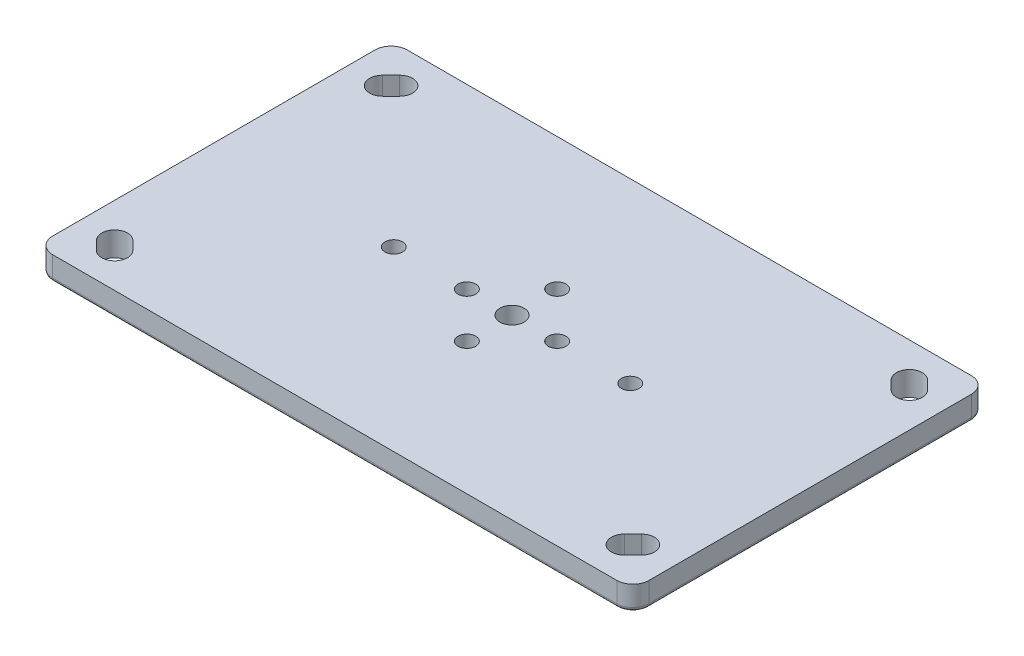
from build123d import *

# Parameters (mm, degrees)
SKETCH1_W                       = 93.98
SKETCH1_H                       = 55.88
SKETCH1_R                       = 1.905
BOSS_EXTRUDE1_DEPTH             = 3.81
F_7_64_0_10938_DIAMETER_HOLE1_D = 2.778252
FILLET1_R                       = 2.54
EXTRUDE_THIN1_DEPTH             = 3.81
FILLET2_R                       = 1.27
FILLET3_R                       = 0.635


with BuildPart() as part:
    # Sketch1 → Boss-Extrude1 (new body)
    with BuildSketch(Plane(origin=(0, 0, 0), x_dir=(1, 0, 0), z_dir=(0, 1, 0))):
        Rectangle(SKETCH1_W, SKETCH1_H)
        with Locations(Location((0, 0, 0), (0, 0, 90))):
            Circle(SKETCH1_R, mode=Mode.SUBTRACT)
        with BuildLine():
            Line((40.073298182, 19.676259764), (38.726259764, 21.023298182))
            ThreePointArc((38.726259764, 21.023298182), (38.726259764, 23.896980141), (41.599941723, 23.896980141))
            Line((41.599941723, 23.896980141), (42.946980141, 22.549941723))
            ThreePointArc((42.946980141, 22.549941723), (42.946980141, 19.676259764), (40.073298182, 19.676259764))
        make_face(mode=Mode.SUBTRACT)
        with BuildLine():
            Line((-40.073298182, 19.676259764), (-38.726259764, 21.023298182))
            ThreePointArc((-38.726259764, 21.023298182), (-38.726259764, 23.896980141), (-41.599941723, 23.896980141))
            Line((-41.599941723, 23.896980141), (-42.946980141, 22.549941723))
            ThreePointArc((-42.946980141, 22.549941723), (-42.946980141, 19.676259764), (-40.073298182, 19.676259764))
        make_face(mode=Mode.SUBTRACT)
        with BuildLine():
            Line((40.073298182, -19.676259764), (38.726259764, -21.023298182))
            ThreePointArc((38.726259764, -21.023298182), (38.726259764, -23.896980141), (41.599941723, -23.896980141))
            Line((41.599941723, -23.896980141), (42.946980141, -22.549941723))
            ThreePointArc((42.946980141, -22.549941723), (42.946980141, -19.676259764), (40.073298182, -19.676259764))
        make_face(mode=Mode.SUBTRACT)
        with BuildLine():
            Line((-40.073298182, -19.676259764), (-38.726259764, -21.023298182))
            ThreePointArc((-38.726259764, -21.023298182), (-38.726259764, -23.896980141), (-41.599941723, -23.896980141))
            Line((-41.599941723, -23.896980141), (-42.946980141, -22.549941723))
            ThreePointArc((-42.946980141, -22.549941723), (-42.946980141, -19.676259764), (-40.073298182, -19.676259764))
        make_face(mode=Mode.SUBTRACT)
    extrude(amount=BOSS_EXTRUDE1_DEPTH)

    # 7/64 (0.10938) Diameter Hole1 (through all)
    with Locations(Plane(origin=(0, 0, 0), x_dir=(-1, 0, 0), z_dir=(0, -1, 0))):
        with Locations((-18.6309, 0), (0, 7.112), (-7.112, 0), (7.112, 0), (18.6309, 0), (0, -7.112)):
            Hole(F_7_64_0_10938_DIAMETER_HOLE1_D / 2)

    # Fillet1
    fillet1_edges = [part.edges().sort_by_distance(p)[0] for p in [
        (-46.99, 1.905, 27.94),
        (46.99, 1.905, 27.94),
        (46.99, 1.905, -27.94),
        (-46.99, 1.905, -27.94),
    ]]
    fillet(fillet1_edges, radius=FILLET1_R)

    # Sketch4 → Extrude-Thin1 (add)
    with BuildSketch(Plane(origin=(0, 0, 0), x_dir=(1, 0, 0), z_dir=(0, 1, 0))):
        with BuildLine():
            Line((-40.64, 10.16), (-40.64, -10.16))
            ThreePointArc((-40.64, -10.16), (-36.920256121, -19.140256121), (-27.94, -22.86))
            Line((-27.94, -22.86), (27.94, -22.86))
            ThreePointArc((27.94, -22.86), (36.920256121, -19.140256121), (40.64, -10.16))
            Line((40.64, -10.16), (40.64, 10.16))
            ThreePointArc((40.64, 10.16), (36.920256121, 19.140256121), (27.94, 22.86))
            Line((27.94, 22.86), (-27.94, 22.86))
            ThreePointArc((-27.94, 22.86), (-36.920256121, 19.140256121), (-40.64, 10.16))
        make_face()
        with BuildLine():
            Line((-36.83, 10.16), (-36.83, -10.16))
            ThreePointArc((-36.83, -10.16), (-34.226179285, -16.446179285), (-27.94, -19.05))
            Line((-27.94, -19.05), (27.94, -19.05))
            ThreePointArc((27.94, -19.05), (34.226179285, -16.446179285), (36.83, -10.16))
            Line((36.83, -10.16), (36.83, 10.16))
            ThreePointArc((36.83, 10.16), (34.226179285, 16.446179285), (27.94, 19.05))
            Line((27.94, 19.05), (-27.94, 19.05))
            ThreePointArc((-27.94, 19.05), (-34.226179285, 16.446179285), (-36.83, 10.16))
        make_face(mode=Mode.SUBTRACT)
    extrude(amount=-EXTRUDE_THIN1_DEPTH)

    # Fillet2
    fillet2_edges = [part.edges().sort_by_distance(p)[0] for p in [
        (-36.920256121, -3.81, 19.140256121),
        (-40.64, -3.81, 0),
        (-36.920256121, -3.81, -19.140256121),
        (0, -3.81, -22.86),
        (36.920256121, -3.81, -19.140256121),
        (40.64, -3.81, 0),
        (36.920256121, -3.81, 19.140256121),
        (0, -3.81, 22.86),
        (-36.83, -3.81, 0),
        (-34.226179285, -3.81, 16.446179285),
        (0, -3.81, 19.05),
        (34.226179285, -3.81, 16.446179285),
        (36.83, -3.81, 0),
        (34.226179285, -3.81, -16.446179285),
        (0, -3.81, -19.05),
        (-34.226179285, -3.81, -16.446179285),
    ]]
    fillet(fillet2_edges, radius=FILLET2_R)

    # Fillet3
    fillet3_edges = [part.edges().sort_by_distance(p)[0] for p in [
        (-46.99, 0, 0),
        (0, 0, -27.94),
        (46.99, 0, 0),
        (0, 0, 27.94),
        (46.246051224, 0, 27.196051224),
        (46.246051224, 0, -27.196051224),
        (-46.246051224, 0, 27.196051224),
        (-46.246051224, 0, -27.196051224),
        (-36.920256121, 0, 19.140256121),
        (0, 0, 22.86),
        (36.920256121, 0, 19.140256121),
        (40.64, 0, 0),
        (36.920256121, 0, -19.140256121),
        (0, 0, -22.86),
        (-36.920256121, 0, -19.140256121),
        (-40.64, 0, 0),
    ]]
    fillet(fillet3_edges, radius=FILLET3_R)


solid = part.part
